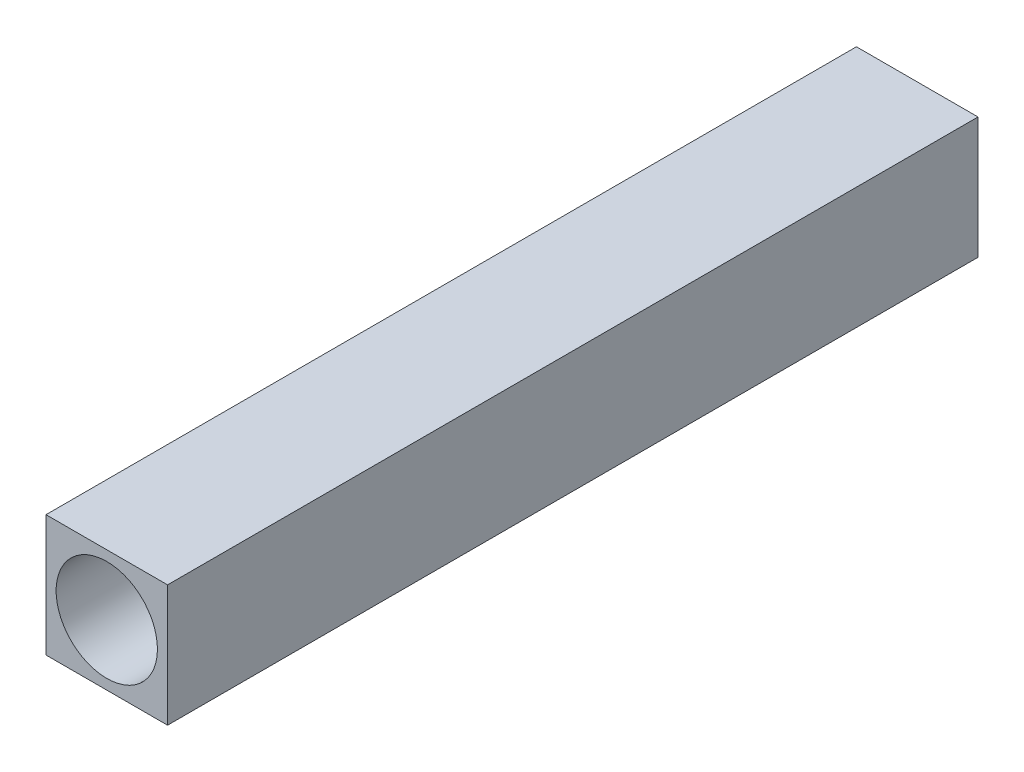
from build123d import *

# Parameters (mm, degrees)
SKETCH1_W           = 30
SKETCH1_H           = 30
SKETCH1_R           = 12.5
BOSS_EXTRUDE1_DEPTH = 100


with BuildPart() as part:
    # Sketch1 → Boss-Extrude1 (new, symmetric)
    with BuildSketch(Plane.XY):
        Rectangle(SKETCH1_W, SKETCH1_H)
        Circle(SKETCH1_R, mode=Mode.SUBTRACT)
    extrude(amount=BOSS_EXTRUDE1_DEPTH, both=True)


solid = part.part
